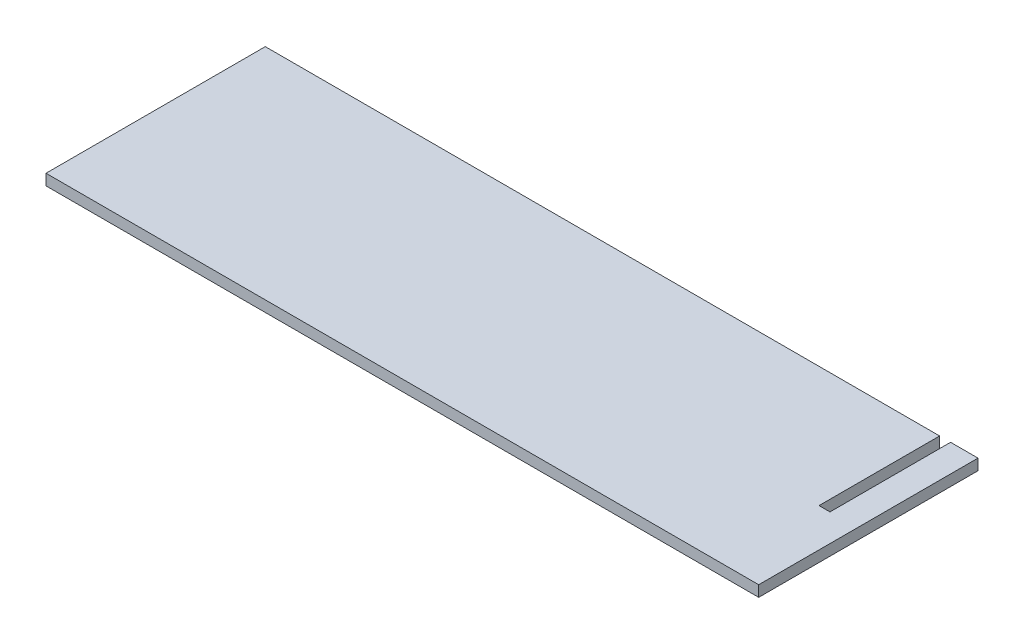
from build123d import *

# Parameters (mm, degrees)
BOSS_EXTRUDE1_DEPTH = 1


with BuildPart() as part:
    # Sketch1 → Boss-Extrude1 (new, symmetric)
    with BuildSketch(Plane(origin=(0, 0, 0), x_dir=(1, 0, 0), z_dir=(0, 1, 0))):
        Polygon((60, 20), (65, 20), (65, -20), (-65, -20), (-65, 20), (58, 20), (58, -2), (60, -2), align=None)
    extrude(amount=BOSS_EXTRUDE1_DEPTH, both=True)


solid = part.part
